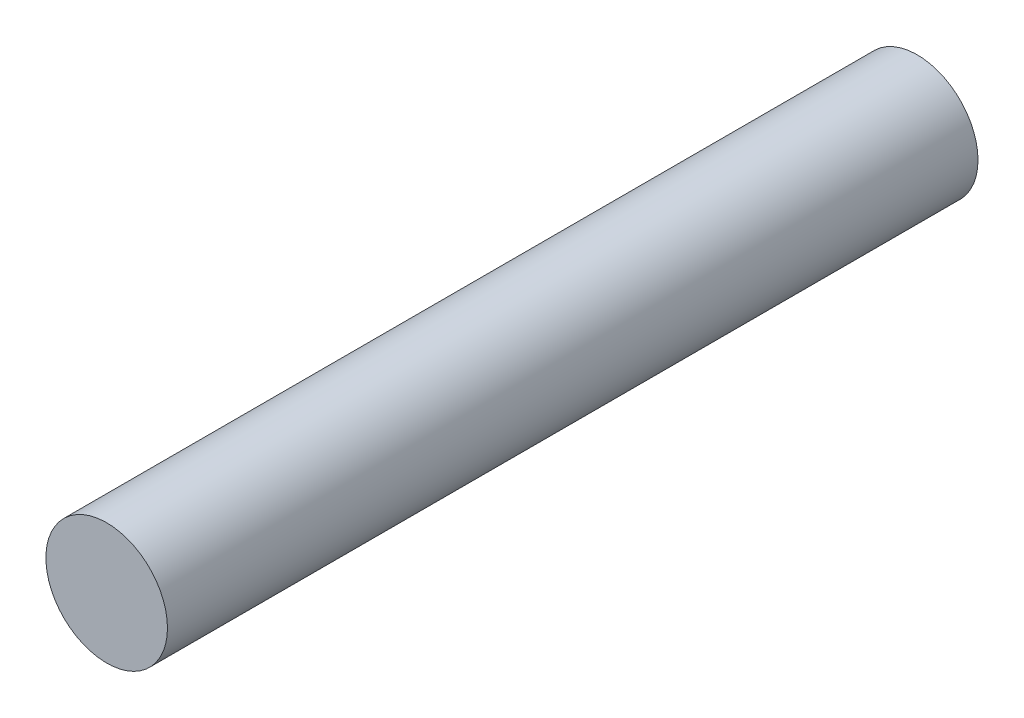
from build123d import *

# Parameters (mm, degrees)
CROQUIS1_R              = 9.525
SALIENTE_EXTRUIR1_DEPTH = 127


with BuildPart() as part:
    # Croquis1 → Saliente-Extruir1 (new body)
    with BuildSketch(Plane.XY):
        Circle(CROQUIS1_R)
    extrude(amount=SALIENTE_EXTRUIR1_DEPTH)


solid = part.part
